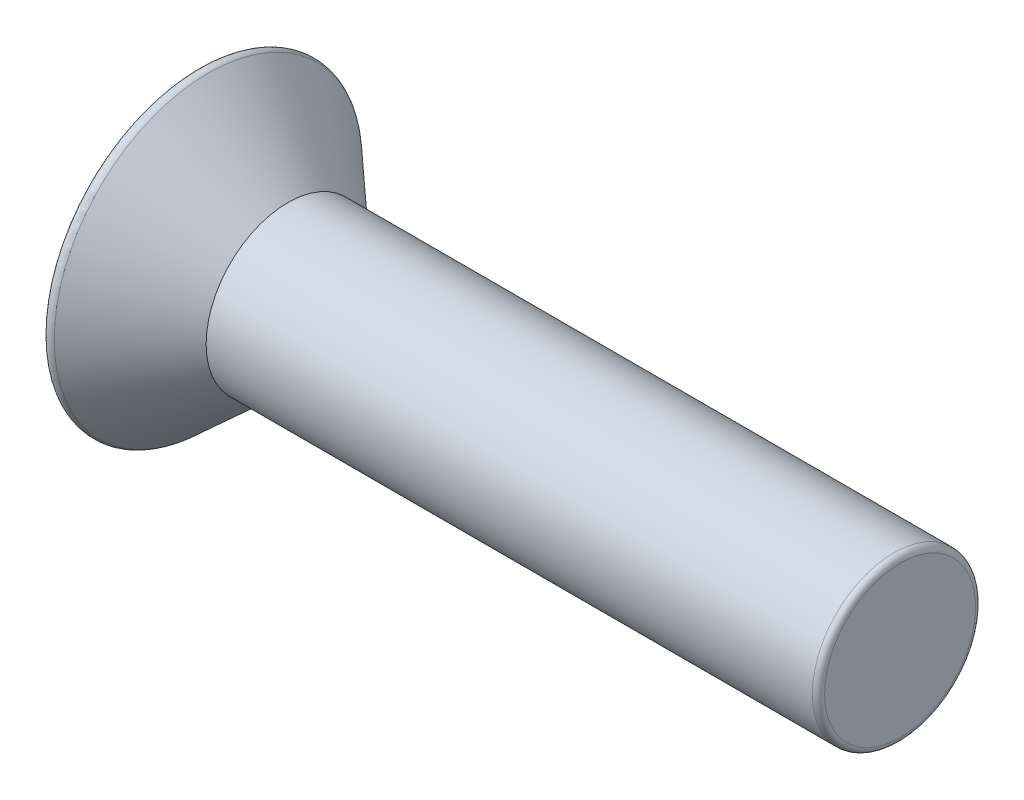
from build123d import *

# Parameters (mm, degrees)
KES_EKSTR_ZYON1_DEPTH = 5
RADYUS2_R             = 0.3


with BuildPart() as part:
    # Çizim1 → Döndür1 (revolve)
    with BuildSketch(Plane.XY, mode=Mode.PRIVATE) as d_nd_r1_sk:
        Polygon((0, 0), (0, 4), (-30, 4), (-34.4, 8), (-34.4, 0), align=None)
    revolve(d_nd_r1_sk.sketch.rotate(Axis((-34.4, 0, 0), (1, 0, 0)), 90), axis=Axis((-34.4, 0, 0), (1, 0, 0)))

    # Çizim2 → Kes-Ekstrüzyon1 (cut)
    with BuildSketch(Plane.ZY.offset(34.4)):
        Polygon((2.886751346, 0), (1.443375673, 2.5), (-1.443375673, 2.5), (-2.886751346, 0), (-1.443375673, -2.5), (1.443375673, -2.5), align=None)
    extrude(amount=-KES_EKSTR_ZYON1_DEPTH, mode=Mode.SUBTRACT)

    # Radyus2
    radyus2_edges = [part.edges().sort_by_distance(p)[0] for p in [
        (-34.4, 0, -8),
        (0, 0, -4),
    ]]
    fillet(radyus2_edges, radius=RADYUS2_R)


solid = part.part
